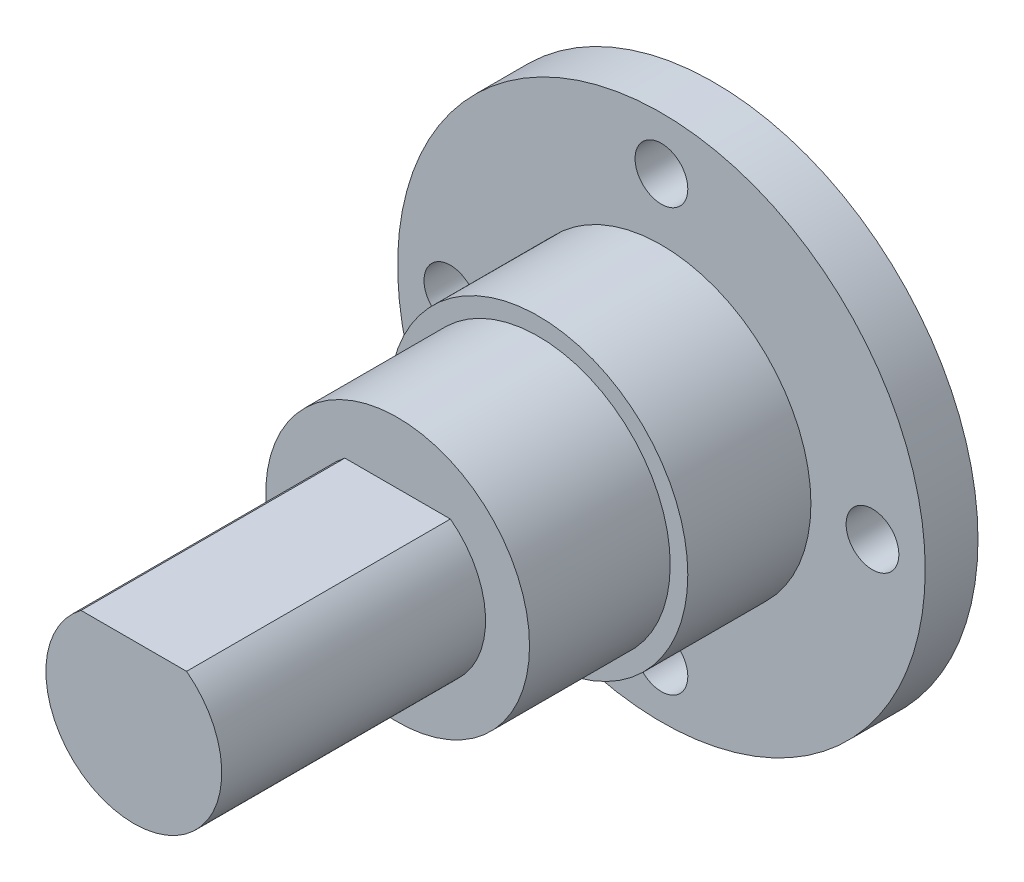
from build123d import *

# Parameters (mm, degrees)
SKETCH_1_R          = 15
EXTRUDE_1_DEPTH     = 3
SKETCH_2_R          = 1.5
CUT_EXTRUDE_1_DEPTH = 22.424285286
SKETCH_5_R          = 5
EXTRUDE_2_DEPTH     = 30
SKETCH_7_R          = 7.5
EXTRUDE_4_DEPTH     = 15
CUT_EXTRUDE_START   = -15
CUT_EXTRUDE_2_DEPTH = 15
SKETCH_9_R          = 8.5
EXTRUDE_5_DEPTH     = 7


with BuildPart() as part:
    # 草图1 → 凸台-拉伸1 (new body)
    with BuildSketch(Plane.XY):
        Circle(SKETCH_1_R)
    extrude(amount=EXTRUDE_1_DEPTH)

    # 草图2 → 切除-拉伸1 (cut, through all)
    with BuildSketch(Plane.XY.offset(3)):
        with Locations((0, 12)):
            Circle(SKETCH_2_R)
        with Locations((12, 0)):
            Circle(SKETCH_2_R)
        with Locations((0, -12)):
            Circle(SKETCH_2_R)
        with Locations((-12, 0)):
            Circle(SKETCH_2_R)
    extrude(amount=-CUT_EXTRUDE_1_DEPTH, mode=Mode.SUBTRACT)

    # 草图5 → 凸台-拉伸2 (add)
    with BuildSketch(Plane.XY.offset(3)):
        Circle(SKETCH_5_R)
    extrude(amount=EXTRUDE_2_DEPTH)

    # 草图7 → 凸台-拉伸4 (add)
    with BuildSketch(Plane.XY.offset(3)):
        Circle(SKETCH_7_R)
    extrude(amount=EXTRUDE_4_DEPTH)

    # 草图8 → 切除-拉伸2 (cut)
    with BuildSketch(Plane.XY.offset(33).offset(CUT_EXTRUDE_START)):
        with BuildLine():
            Line((-3, 4), (3, 4))
            ThreePointArc((3, 4), (0, 5), (-3, 4))
        make_face()
    extrude(amount=CUT_EXTRUDE_2_DEPTH, mode=Mode.SUBTRACT)

    # 草图9 → 凸台-拉伸5 (add)
    with BuildSketch(Plane.XY.offset(3)):
        Circle(SKETCH_9_R)
    extrude(amount=EXTRUDE_5_DEPTH)


solid = part.part
